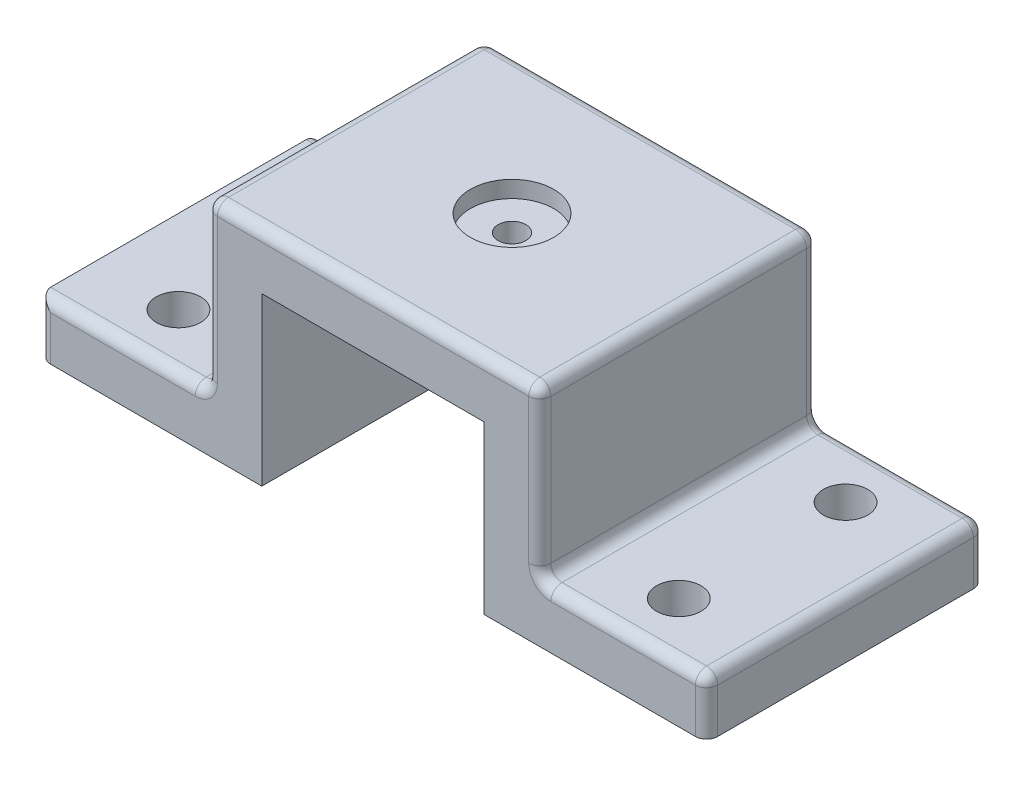
from build123d import *

# Parameters (mm, degrees)
EXTRUDE_THIN1_DEPTH                                 = 31.75
CBORE_FOR_00_BINDING_HEAD_MACHINE_SCREW_D           = 6.35
CBORE_FOR_00_BINDING_HEAD_MACHINE_SCREW_CBORE_D     = 19.05
CBORE_FOR_00_BINDING_HEAD_MACHINE_SCREW_CBORE_DEPTH = 3.81
SKETCH7_R                                           = 5.08
CUT_EXTRUDE1_DEPTH                                  = 91.918163752
LPATTERN1_COUNT                                     = 2
LPATTERN1_PITCH                                     = 38.1
LPATTERN1_COUNT_DIR2                                = 2
LPATTERN1_PITCH_DIR2                                = 114.3
FILLET1_R                                           = 2.54


with BuildPart() as part:
    # Sketch1 → Extrude-Thin1 (new, symmetric)
    with BuildSketch(Plane.XY):
        Polygon((-76.2, 0), (-25.4, 0), (-25.4, 38.1), (25.4, 38.1), (25.4, 0), (76.2, 0), (76.2, 12.7), (38.1, 12.7), (38.1, 50.8), (-38.1, 50.8), (-38.1, 12.7), (-76.2, 12.7), align=None)
    extrude(amount=EXTRUDE_THIN1_DEPTH, both=True)

    # CBORE for #00 Binding Head Machine Screw2 (through all)
    with Locations(Plane(origin=(0, 50.8, 0), x_dir=(1, 0, 0), z_dir=(0, 1, 0))):
        with Locations((0, 0)):
            CounterBoreHole(CBORE_FOR_00_BINDING_HEAD_MACHINE_SCREW_D / 2, CBORE_FOR_00_BINDING_HEAD_MACHINE_SCREW_CBORE_D / 2, CBORE_FOR_00_BINDING_HEAD_MACHINE_SCREW_CBORE_DEPTH)

    # Sketch7 → Cut-Extrude1 (cut, through all)
    with BuildSketch(Plane(origin=(0, 12.7, 0), x_dir=(1, 0, 0), z_dir=(0, 1, 0))):
        with Locations(Location((-57.15, -19.05, 0), (0, 0, 270))):
            Circle(SKETCH7_R)
    cut_extrude1 = extrude(amount=-CUT_EXTRUDE1_DEPTH, mode=Mode.SUBTRACT)

    # LPattern1: Cut-Extrude1 2 × 2
    with Locations(*[(j * LPATTERN1_PITCH_DIR2, 0, -i * LPATTERN1_PITCH) for i in range(LPATTERN1_COUNT) for j in range(LPATTERN1_COUNT_DIR2) if (i, j) != (0, 0)]):
        add(cut_extrude1, mode=Mode.SUBTRACT)

    # Fillet1
    fillet1_edges = [part.edges().sort_by_distance(p)[0] for p in [
        (-76.2, 6.35, -31.75),
        (-57.15, 12.7, -31.75),
        (-38.1, 31.75, -31.75),
        (0, 50.8, -31.75),
        (57.15, 12.7, 31.75),
        (38.1, 31.75, -31.75),
        (57.15, 12.7, -31.75),
        (76.2, 6.35, -31.75),
        (38.1, 31.75, 31.75),
        (-38.1, 12.7, 0),
        (-38.1, 50.8, 0),
        (38.1, 50.8, 0),
        (38.1, 12.7, 0),
        (76.2, 12.7, 0),
        (0, 50.8, 31.75),
        (-38.1, 31.75, 31.75),
        (-57.15, 12.7, 31.75),
        (-76.2, 6.35, 31.75),
        (76.2, 6.35, 31.75),
    ]]
    fillet(fillet1_edges, radius=FILLET1_R)


solid = part.part
